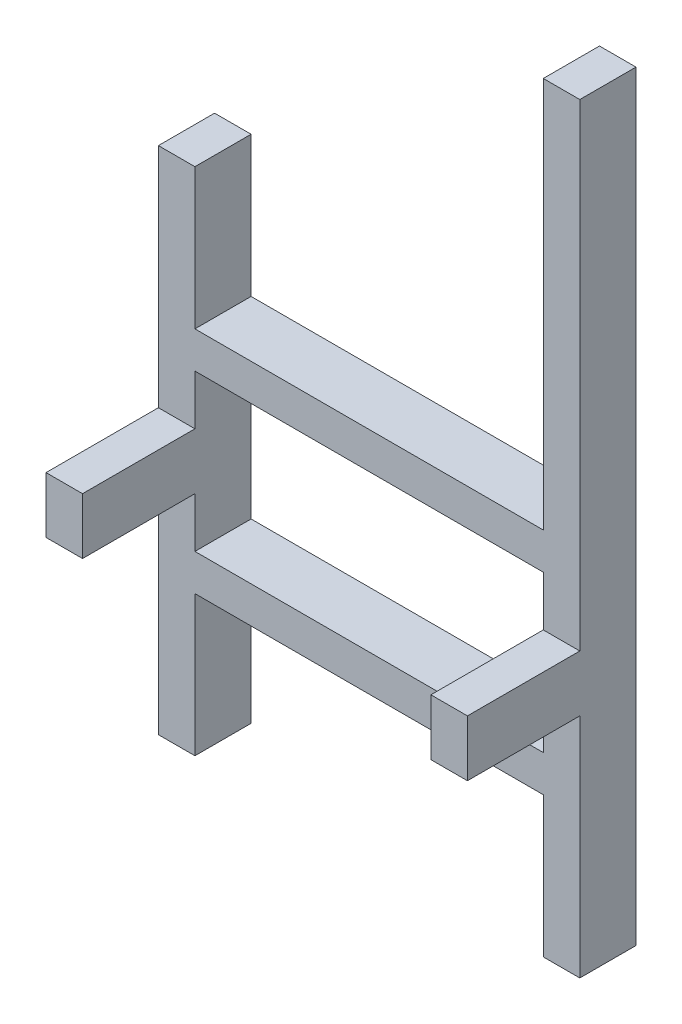
from build123d import *

# Parameters (mm, degrees)
SKETCH1_W           = 6.5
SKETCH1_H           = 90.8
SKETCH1_H_2         = 135.4
SKETCH1_W_2         = 62
SKETCH1_H_3         = 6.5
BOSS_EXTRUDE1_DEPTH = 10
SKETCH2_W           = 6.5
SKETCH2_H           = 10
BOSS_EXTRUDE2_DEPTH = 20


with BuildPart() as part:
    # Sketch1 → Boss-Extrude1 (new body)
    with BuildSketch(Plane.XY):
        with Locations((3.25, 45.4)):
            Rectangle(SKETCH1_W, SKETCH1_H)
        with Locations((71.75, 67.7)):
            Rectangle(SKETCH1_W, SKETCH1_H_2)
        with Locations((37.5, 28.25)):
            Rectangle(SKETCH1_W_2, SKETCH1_H_3)
        with Locations((37.5, 62.55)):
            Rectangle(SKETCH1_W_2, SKETCH1_H_3)
    extrude(amount=BOSS_EXTRUDE1_DEPTH)

    # Sketch2 → Boss-Extrude2 (add)
    with BuildSketch(Plane.XY.offset(10)):
        with Locations((3.25, 45.4)):
            Rectangle(SKETCH2_W, SKETCH2_H)
        with Locations((71.75, 45.4)):
            Rectangle(SKETCH2_W, SKETCH2_H)
    extrude(amount=BOSS_EXTRUDE2_DEPTH)


solid = part.part
